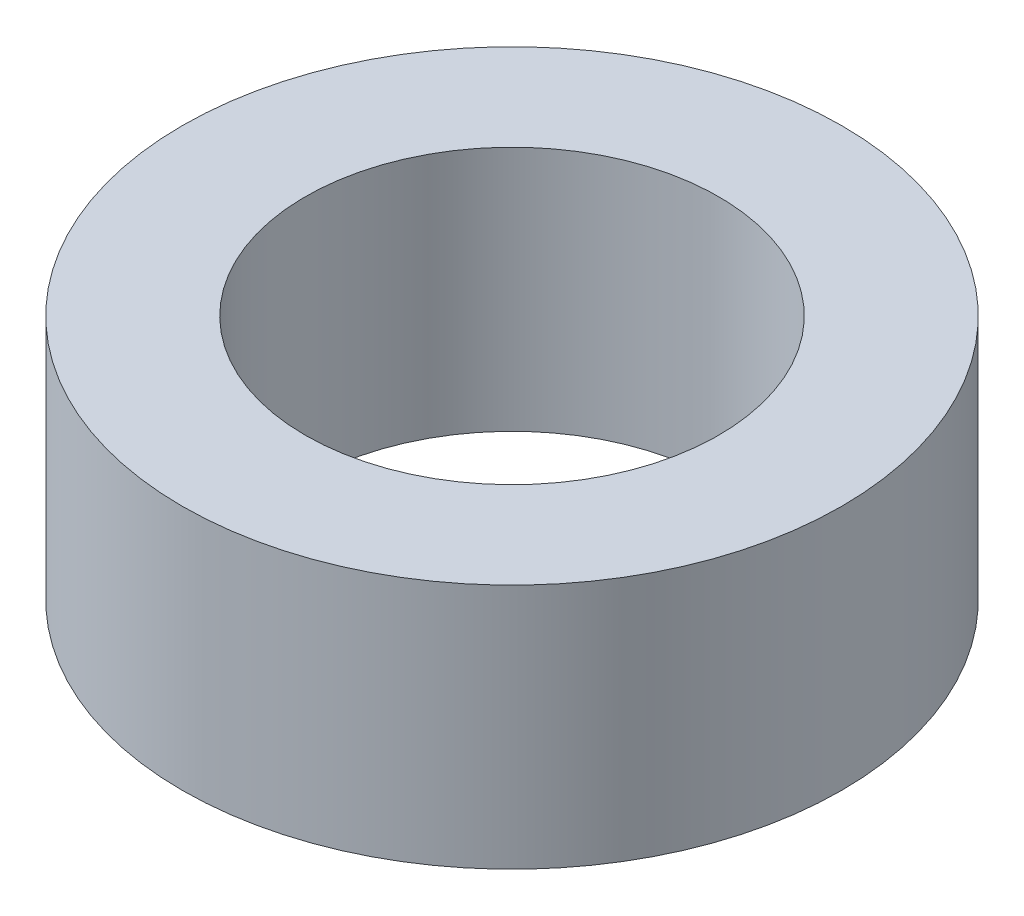
from build123d import *

# Parameters (mm, degrees)
SKETCH1_R           = 3.35
SKETCH1_R_2         = 2.1
BOSS_EXTRUDE1_DEPTH = 2.5


with BuildPart() as part:
    # Sketch1 → Boss-Extrude1 (new body)
    with BuildSketch(Plane(origin=(0, 0, 0), x_dir=(1, 0, 0), z_dir=(0, 1, 0))):
        with Locations(Location((0, 0, 0), (0, 0, 270))):
            Circle(SKETCH1_R)
        with Locations(Location((0, 0, 0), (0, 0, 270))):
            Circle(SKETCH1_R_2, mode=Mode.SUBTRACT)
    extrude(amount=BOSS_EXTRUDE1_DEPTH)


solid = part.part
